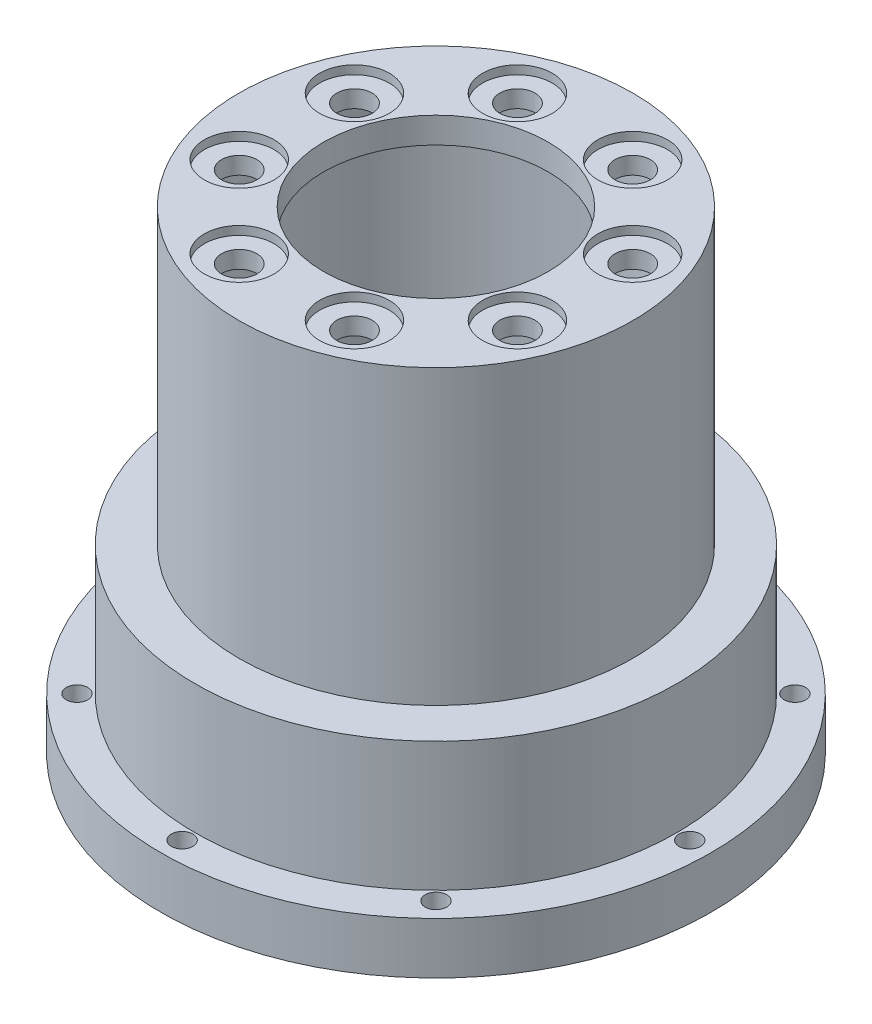
from build123d import *

# Parameters (mm, degrees)
HOLE_WIZARD_M3_1_D       = 2.5
PATTERN_CIRCULAR_1_COUNT = 2
PATTERN_CIRCULAR_1_ANGLE = 45
SKETCH_5_R               = 2.05
CUT_EXTRUDE_1_DEPTH      = 10
PATTERN_CIRCULAR_2_COUNT = 8
SKETCH_6_R               = 4.05
CUT_EXTRUDE_2_DEPTH      = 1
PATTERN_CIRCULAR_3_COUNT = 8


with BuildPart() as part:
    # 草图1 → 旋转1 (revolve)
    with BuildSketch(Plane.XY, mode=Mode.PRIVATE) as revolve_1_sk:
        Polygon((32, 0), (32, 6), (28, 6), (28, 21), (22.9, 21), (22.9, 55), (13.05, 55), (13.05, 52), (21.1, 52), (21.1, 18), (26, 18), (26, 0), align=None)
    revolve(revolve_1_sk.sketch.rotate(Axis((0, 0, 0), (0, 1, 0)), 90), axis=Axis((0, 0, 0), (0, 1, 0)))

    # M3 螺纹孔1 (through all)
    with Locations(Plane(origin=(0, 0, 0), x_dir=(-1, 0, 0), z_dir=(0, -1, 0))):
        with Locations((0, 29.5), (29.5, 0), (0, -29.5), (-29.5, 0)):
            hole_wizard_m3_1 = Hole(HOLE_WIZARD_M3_1_D / 2)

    # 阵列(圆周)1: M3 螺纹孔1 ×2 about axis
    pattern_circular_1_axis = Axis((0, 0, 0), (0, -1, 0))
    for i in range(1, PATTERN_CIRCULAR_1_COUNT):
        add(hole_wizard_m3_1.rotate(pattern_circular_1_axis, i * PATTERN_CIRCULAR_1_ANGLE / (PATTERN_CIRCULAR_1_COUNT - 1)), mode=Mode.SUBTRACT)

    # 草图5 → 切除-拉伸1 (cut)
    with BuildSketch(Plane(origin=(0, 55, 0), x_dir=(1, 0, 0), z_dir=(0, 1, 0))):
        with Locations(Location((-6.696960066, 16.167891819, 0), (0, 0, 270))):
            Circle(SKETCH_5_R)
    cut_extrude_1 = extrude(amount=-CUT_EXTRUDE_1_DEPTH, mode=Mode.SUBTRACT)

    # 阵列(圆周)2: 切除-拉伸1 ×8 about axis
    pattern_circular_2_axis = Axis((0, 0, 0), (0, 1, 0))
    for i in range(1, PATTERN_CIRCULAR_2_COUNT):
        add(cut_extrude_1.rotate(pattern_circular_2_axis, i * 360 / PATTERN_CIRCULAR_2_COUNT), mode=Mode.SUBTRACT)

    # 草图6 → 切除-拉伸2 (cut)
    with BuildSketch(Plane(origin=(0, 55, 0), x_dir=(1, 0, 0), z_dir=(0, 1, 0))):
        with Locations(Location((-6.696960066, 16.167891819, 0), (0, 0, 270))):
            Circle(SKETCH_6_R)
    cut_extrude_2 = extrude(amount=-CUT_EXTRUDE_2_DEPTH, mode=Mode.SUBTRACT)

    # 阵列(圆周)3: 切除-拉伸2 ×8 about axis
    pattern_circular_3_axis = Axis((0, 0, 0), (0, 1, 0))
    for i in range(1, PATTERN_CIRCULAR_3_COUNT):
        add(cut_extrude_2.rotate(pattern_circular_3_axis, i * 360 / PATTERN_CIRCULAR_3_COUNT), mode=Mode.SUBTRACT)


solid = part.part
